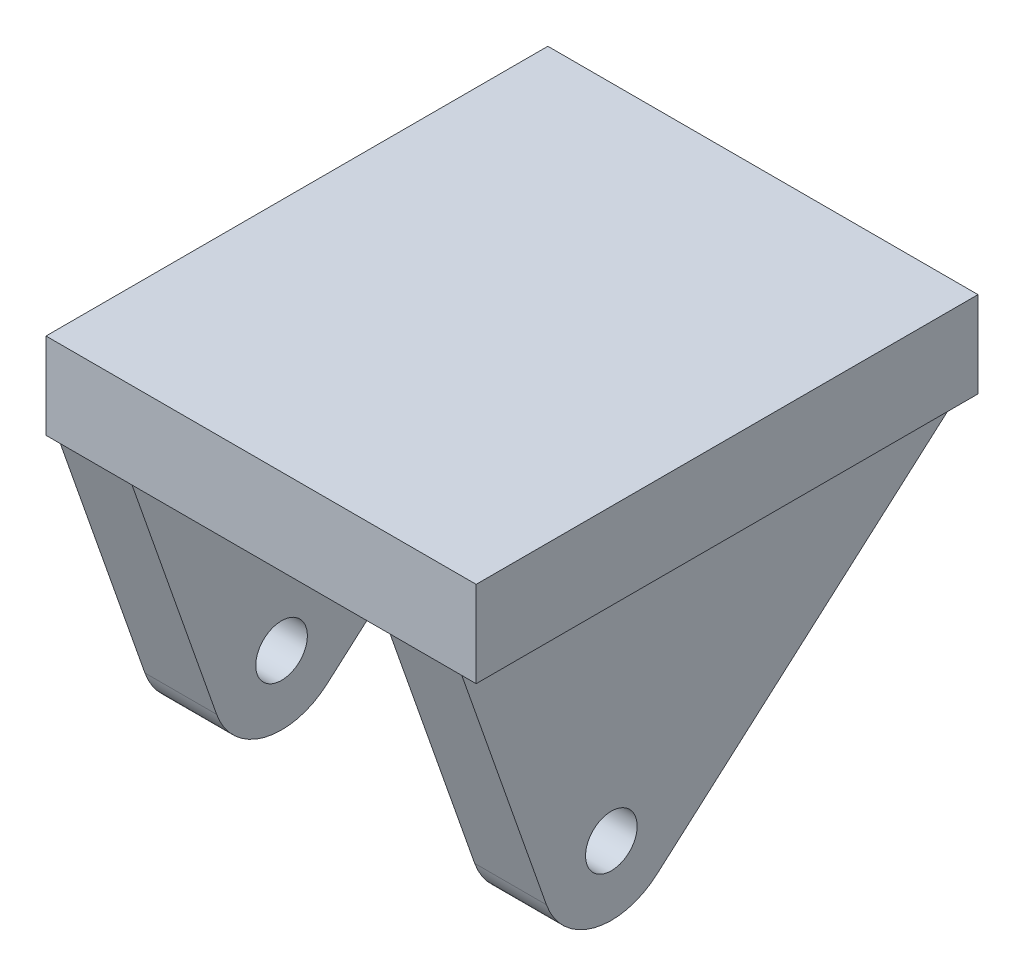
from build123d import *

# Parameters (mm, degrees)
ESQUISSE1_W                = 30
ESQUISSE1_H                = 6
BOSS_EXTRU_1_DEPTH         = 17.5
ESQUISSE3_R                = 1.8
BOSS_EXTRU_2_DEPTH         = 5
R_P_TITION_LIN_AIRE1_COUNT = 2
R_P_TITION_LIN_AIRE1_PITCH = 23


with BuildPart() as part:
    # Esquisse1 → Boss.-Extru.1 (new, symmetric)
    with BuildSketch(Plane.XY):
        with Locations((0, -3)):
            Rectangle(ESQUISSE1_W, ESQUISSE1_H)
    extrude(amount=BOSS_EXTRU_1_DEPTH, both=True)

    # Esquisse3 → Boss.-Extru.2 (add)
    with BuildSketch(Plane(origin=(14, 0, 0), x_dir=(0, 0, -1), z_dir=(1, 0, 0))):
        with BuildLine():
            Line((-17.5, -6), (17.5, -6))
            Line((17.5, -6), (-3.901517868, -24.817916067))
            ThreePointArc((-3.901517868, -24.817916067), (-8.286202576, -25.856849364), (-11.600005345, -22.803399907))
            Line((-11.600005345, -22.803399907), (-17.5, -6))
        make_face()
        with Locations((-7.071067812, -21.213203436)):
            Circle(ESQUISSE3_R, mode=Mode.SUBTRACT)
    boss_extru_2 = extrude(amount=-BOSS_EXTRU_2_DEPTH)

    # Répétition linéaire1: Boss.-Extru.2 ×2
    with Locations(*[(-i * R_P_TITION_LIN_AIRE1_PITCH, 0, 0) for i in range(1, R_P_TITION_LIN_AIRE1_COUNT)]):
        add(boss_extru_2)


solid = part.part
